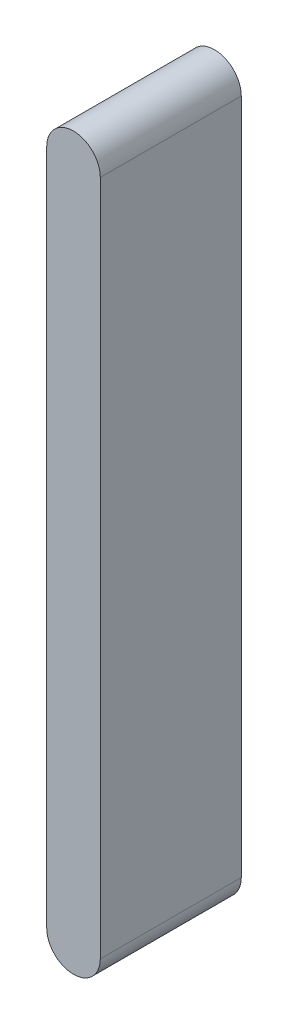
from build123d import *

# Parameters (mm, degrees)
EXTRUDE_1_DEPTH = 10


with BuildPart() as part:
    # 草图1 → 凸台-拉伸1 (new body)
    with BuildSketch(Plane.XY):
        with BuildLine():
            Line((1.9, 17.359090909), (1.9, -30.640909091))
            ThreePointArc((1.9, -30.640909091), (0, -32.540909091), (-1.9, -30.640909091))
            Line((-1.9, -30.640909091), (-1.9, 17.359090909))
            ThreePointArc((-1.9, 17.359090909), (0, 19.259090909), (1.9, 17.359090909))
        make_face()
    extrude(amount=EXTRUDE_1_DEPTH)


solid = part.part
